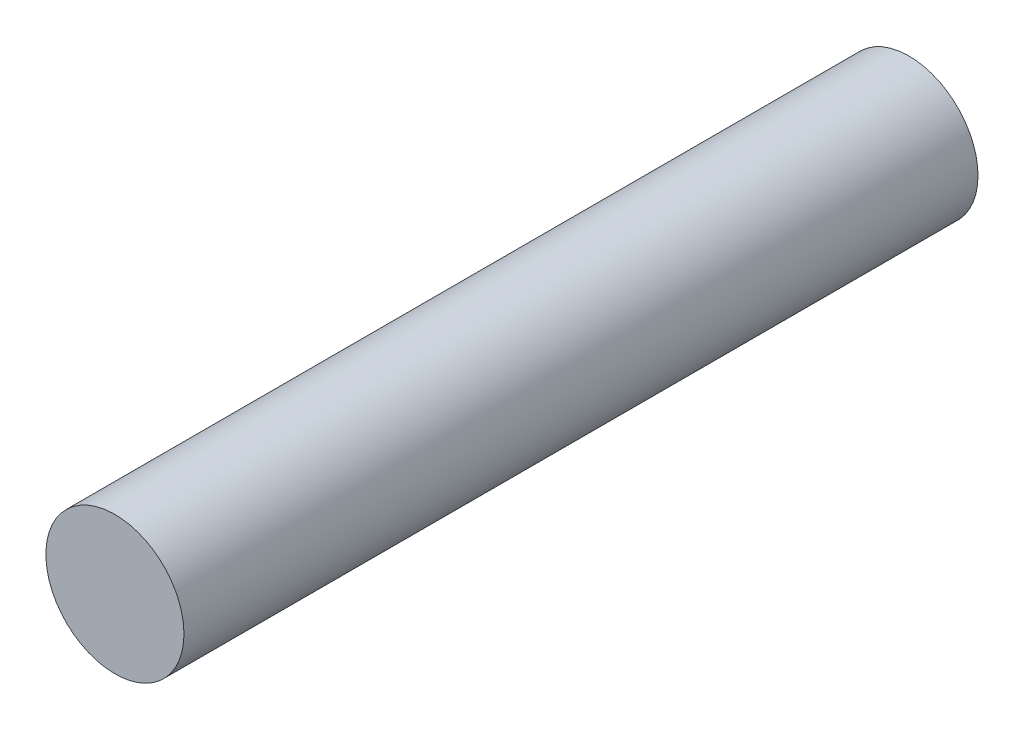
from build123d import *

# Parameters (mm, degrees)
SKETCH_1_R      = 2
EXTRUDE_1_DEPTH = 10
SKETCH_2_R      = 2
EXTRUDE_2_DEPTH = 13


with BuildPart() as part:
    # 草图1 → 凸台-拉伸1 (new body)
    with BuildSketch(Plane.XY):
        Circle(SKETCH_1_R)
    extrude(amount=EXTRUDE_1_DEPTH)

    # 草图2 → 凸台-拉伸2 (add)
    with BuildSketch(Plane.XY.offset(10)):
        Circle(SKETCH_2_R)
    extrude(amount=EXTRUDE_2_DEPTH)


solid = part.part
